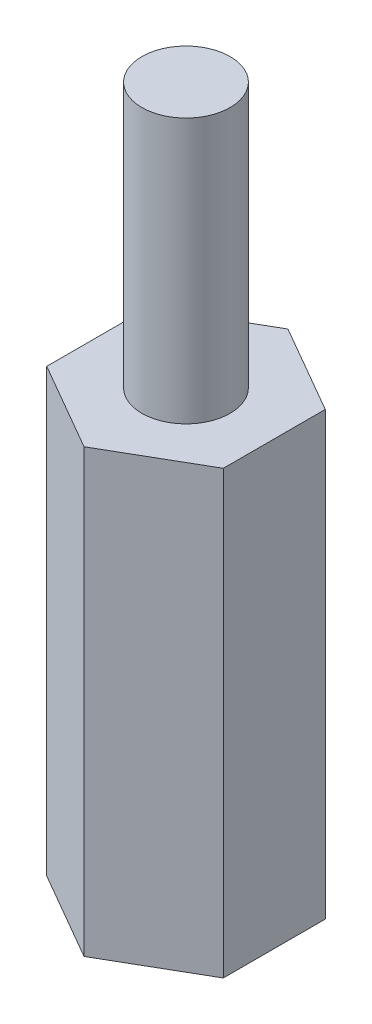
from build123d import *

# Parameters (mm, degrees)
EXTRUDE_1_DEPTH = 10
SKETCH_2_R      = 1
EXTRUDE_2_DEPTH = 6


with BuildPart() as part:
    # Эскиз1 → Бобышка-Вытянуть1 (new body)
    with BuildSketch(Plane(origin=(0, 0, 0), x_dir=(1, 0, 0), z_dir=(0, 1, 0))):
        Polygon((0, -2.309401077), (2, -1.154700538), (2, 1.154700538), (0, 2.309401077), (-2, 1.154700538), (-2, -1.154700538), align=None)
    extrude(amount=EXTRUDE_1_DEPTH)

    # Эскиз2 → Бобышка-Вытянуть2 (add)
    with BuildSketch(Plane(origin=(0, 10, 0), x_dir=(1, 0, 0), z_dir=(0, 1, 0))):
        with Locations(Location((0, 0, 0), (0, 0, 270))):
            Circle(SKETCH_2_R)
    extrude(amount=EXTRUDE_2_DEPTH)


solid = part.part
